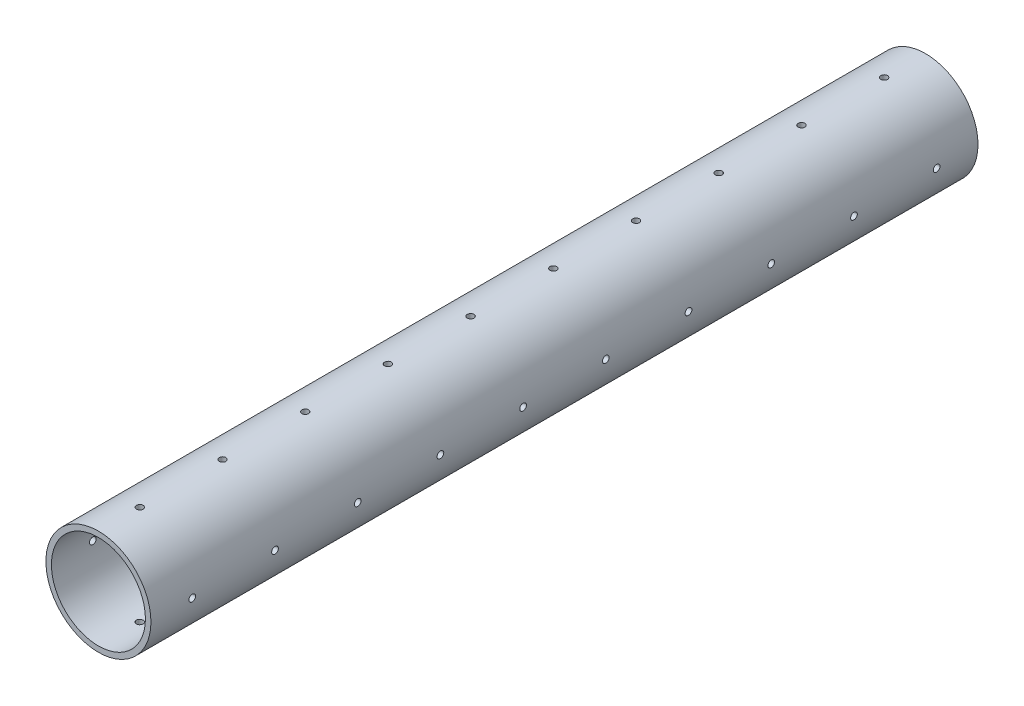
from build123d import *

# Parameters (mm, degrees)
SKETCH1_R                           = 15.875
SKETCH1_R_2                         = 14.210807843
BOSS_EXTRUDE1_DEPTH                 = 250
CUT_EXTRUDE1_REACH                  = 253.006
CUT_EXTRUDE1_END_RADIUS             = 15.875
SKETCH2_R                           = 1.0125
CUT_EXTRUDE1_DIRECTION_2_REACH      = 253.006
CUT_EXTRUDE1_DIRECTION_2_END_RADIUS = 15.875
CUT_EXTRUDE2_REACH                  = 253.006
CUT_EXTRUDE2_END_RADIUS             = 15.875
SKETCH3_R                           = 1.0125
CUT_EXTRUDE2_DIRECTION_2_REACH      = 253.006
CUT_EXTRUDE2_DIRECTION_2_END_RADIUS = 15.875


with BuildPart() as part:
    # Sketch1 → Boss-Extrude1 (new body)
    with BuildSketch(Plane.XY):
        Circle(SKETCH1_R)
        Circle(SKETCH1_R_2, mode=Mode.SUBTRACT)
    extrude(amount=BOSS_EXTRUDE1_DEPTH)

    # Cut-Extrude1: up to this cylinder (the profile starts inside it)
    cut_extrude1_end = Plane(origin=(0, 0, 175), z_dir=(0, 0, -1)) * Cylinder(CUT_EXTRUDE1_END_RADIUS, 863.762, mode=Mode.PRIVATE)
    # Sketch2 → Cut-Extrude1 (cut, up to the surface)
    with BuildSketch(Plane(origin=(0, 0, 0), x_dir=(1, 0, 0), z_dir=(0, 1, 0)), mode=Mode.PRIVATE) as cut_extrude1_sk1:
        with Locations(Location((0, -12.5, 0), (0, 0, 270))):
            Circle(SKETCH2_R)
    cut_extrude1_tool1 = extrude(cut_extrude1_sk1.sketch, amount=-CUT_EXTRUDE1_REACH, mode=Mode.PRIVATE) & cut_extrude1_end
    add(cut_extrude1_tool1.solids().sort_by_distance((0, 0, 12.5))[0], mode=Mode.SUBTRACT)
    # Sketch2 → Cut-Extrude1 (cut, up to the surface)
    with BuildSketch(Plane(origin=(0, 0, 0), x_dir=(1, 0, 0), z_dir=(0, 1, 0)), mode=Mode.PRIVATE) as cut_extrude1_sk2:
        with Locations((0, -312.5)):
            Circle(SKETCH2_R)
    cut_extrude1_tool2 = extrude(cut_extrude1_sk2.sketch, amount=-CUT_EXTRUDE1_REACH, mode=Mode.PRIVATE) & cut_extrude1_end
    add(cut_extrude1_tool2.solids().sort_by_distance((0, 0, 312.5))[0], mode=Mode.SUBTRACT)
    # Sketch2 → Cut-Extrude1 (cut, up to the surface)
    with BuildSketch(Plane(origin=(0, 0, 0), x_dir=(1, 0, 0), z_dir=(0, 1, 0)), mode=Mode.PRIVATE) as cut_extrude1_sk3:
        with Locations(Location((0, -37.5, 0), (0, 0, 270))):
            Circle(SKETCH2_R)
    cut_extrude1_tool3 = extrude(cut_extrude1_sk3.sketch, amount=-CUT_EXTRUDE1_REACH, mode=Mode.PRIVATE) & cut_extrude1_end
    add(cut_extrude1_tool3.solids().sort_by_distance((0, 0, 37.5))[0], mode=Mode.SUBTRACT)
    # Sketch2 → Cut-Extrude1 (cut, up to the surface)
    with BuildSketch(Plane(origin=(0, 0, 0), x_dir=(1, 0, 0), z_dir=(0, 1, 0)), mode=Mode.PRIVATE) as cut_extrude1_sk4:
        with Locations(Location((0, -62.5, 0), (0, 0, 270))):
            Circle(SKETCH2_R)
    cut_extrude1_tool4 = extrude(cut_extrude1_sk4.sketch, amount=-CUT_EXTRUDE1_REACH, mode=Mode.PRIVATE) & cut_extrude1_end
    add(cut_extrude1_tool4.solids().sort_by_distance((0, 0, 62.5))[0], mode=Mode.SUBTRACT)
    # Sketch2 → Cut-Extrude1 (cut, up to the surface)
    with BuildSketch(Plane(origin=(0, 0, 0), x_dir=(1, 0, 0), z_dir=(0, 1, 0)), mode=Mode.PRIVATE) as cut_extrude1_sk5:
        with Locations(Location((0, -87.5, 0), (0, 0, 270))):
            Circle(SKETCH2_R)
    cut_extrude1_tool5 = extrude(cut_extrude1_sk5.sketch, amount=-CUT_EXTRUDE1_REACH, mode=Mode.PRIVATE) & cut_extrude1_end
    add(cut_extrude1_tool5.solids().sort_by_distance((0, 0, 87.5))[0], mode=Mode.SUBTRACT)
    # Sketch2 → Cut-Extrude1 (cut, up to the surface)
    with BuildSketch(Plane(origin=(0, 0, 0), x_dir=(1, 0, 0), z_dir=(0, 1, 0)), mode=Mode.PRIVATE) as cut_extrude1_sk6:
        with Locations(Location((0, -112.5, 0), (0, 0, 270))):
            Circle(SKETCH2_R)
    cut_extrude1_tool6 = extrude(cut_extrude1_sk6.sketch, amount=-CUT_EXTRUDE1_REACH, mode=Mode.PRIVATE) & cut_extrude1_end
    add(cut_extrude1_tool6.solids().sort_by_distance((0, 0, 112.5))[0], mode=Mode.SUBTRACT)
    # Sketch2 → Cut-Extrude1 (cut, up to the surface)
    with BuildSketch(Plane(origin=(0, 0, 0), x_dir=(1, 0, 0), z_dir=(0, 1, 0)), mode=Mode.PRIVATE) as cut_extrude1_sk7:
        with Locations(Location((0, -137.5, 0), (0, 0, 270))):
            Circle(SKETCH2_R)
    cut_extrude1_tool7 = extrude(cut_extrude1_sk7.sketch, amount=-CUT_EXTRUDE1_REACH, mode=Mode.PRIVATE) & cut_extrude1_end
    add(cut_extrude1_tool7.solids().sort_by_distance((0, 0, 137.5))[0], mode=Mode.SUBTRACT)
    # Sketch2 → Cut-Extrude1 (cut, up to the surface)
    with BuildSketch(Plane(origin=(0, 0, 0), x_dir=(1, 0, 0), z_dir=(0, 1, 0)), mode=Mode.PRIVATE) as cut_extrude1_sk8:
        with Locations(Location((0, -162.5, 0), (0, 0, 270))):
            Circle(SKETCH2_R)
    cut_extrude1_tool8 = extrude(cut_extrude1_sk8.sketch, amount=-CUT_EXTRUDE1_REACH, mode=Mode.PRIVATE) & cut_extrude1_end
    add(cut_extrude1_tool8.solids().sort_by_distance((0, 0, 162.5))[0], mode=Mode.SUBTRACT)
    # Sketch2 → Cut-Extrude1 (cut, up to the surface)
    with BuildSketch(Plane(origin=(0, 0, 0), x_dir=(1, 0, 0), z_dir=(0, 1, 0)), mode=Mode.PRIVATE) as cut_extrude1_sk9:
        with Locations(Location((0, -187.5, 0), (0, 0, 270))):
            Circle(SKETCH2_R)
    cut_extrude1_tool9 = extrude(cut_extrude1_sk9.sketch, amount=-CUT_EXTRUDE1_REACH, mode=Mode.PRIVATE) & cut_extrude1_end
    add(cut_extrude1_tool9.solids().sort_by_distance((0, 0, 187.5))[0], mode=Mode.SUBTRACT)
    # Sketch2 → Cut-Extrude1 (cut, up to the surface)
    with BuildSketch(Plane(origin=(0, 0, 0), x_dir=(1, 0, 0), z_dir=(0, 1, 0)), mode=Mode.PRIVATE) as cut_extrude1_sk10:
        with Locations(Location((0, -212.5, 0), (0, 0, 270))):
            Circle(SKETCH2_R)
    cut_extrude1_tool10 = extrude(cut_extrude1_sk10.sketch, amount=-CUT_EXTRUDE1_REACH, mode=Mode.PRIVATE) & cut_extrude1_end
    add(cut_extrude1_tool10.solids().sort_by_distance((0, 0, 212.5))[0], mode=Mode.SUBTRACT)
    # Sketch2 → Cut-Extrude1 (cut, up to the surface)
    with BuildSketch(Plane(origin=(0, 0, 0), x_dir=(1, 0, 0), z_dir=(0, 1, 0)), mode=Mode.PRIVATE) as cut_extrude1_sk11:
        with Locations(Location((0, -237.5, 0), (0, 0, 270))):
            Circle(SKETCH2_R)
    cut_extrude1_tool11 = extrude(cut_extrude1_sk11.sketch, amount=-CUT_EXTRUDE1_REACH, mode=Mode.PRIVATE) & cut_extrude1_end
    add(cut_extrude1_tool11.solids().sort_by_distance((0, 0, 237.5))[0], mode=Mode.SUBTRACT)
    # Sketch2 → Cut-Extrude1 (cut, up to the surface)
    with BuildSketch(Plane(origin=(0, 0, 0), x_dir=(1, 0, 0), z_dir=(0, 1, 0)), mode=Mode.PRIVATE) as cut_extrude1_sk12:
        with Locations((0, -262.5)):
            Circle(SKETCH2_R)
    cut_extrude1_tool12 = extrude(cut_extrude1_sk12.sketch, amount=-CUT_EXTRUDE1_REACH, mode=Mode.PRIVATE) & cut_extrude1_end
    add(cut_extrude1_tool12.solids().sort_by_distance((0, 0, 262.5))[0], mode=Mode.SUBTRACT)
    # Sketch2 → Cut-Extrude1 (cut, up to the surface)
    with BuildSketch(Plane(origin=(0, 0, 0), x_dir=(1, 0, 0), z_dir=(0, 1, 0)), mode=Mode.PRIVATE) as cut_extrude1_sk13:
        with Locations((0, -287.5)):
            Circle(SKETCH2_R)
    cut_extrude1_tool13 = extrude(cut_extrude1_sk13.sketch, amount=-CUT_EXTRUDE1_REACH, mode=Mode.PRIVATE) & cut_extrude1_end
    add(cut_extrude1_tool13.solids().sort_by_distance((0, 0, 287.5))[0], mode=Mode.SUBTRACT)
    # Sketch2 → Cut-Extrude1 (cut, up to the surface)
    with BuildSketch(Plane(origin=(0, 0, 0), x_dir=(1, 0, 0), z_dir=(0, 1, 0)), mode=Mode.PRIVATE) as cut_extrude1_sk14:
        with Locations((0, -337.5)):
            Circle(SKETCH2_R)
    cut_extrude1_tool14 = extrude(cut_extrude1_sk14.sketch, amount=-CUT_EXTRUDE1_REACH, mode=Mode.PRIVATE) & cut_extrude1_end
    add(cut_extrude1_tool14.solids().sort_by_distance((0, 0, 337.5))[0], mode=Mode.SUBTRACT)

    # Cut-Extrude1 direction 2: up to this cylinder (the profile starts inside it)
    cut_extrude1_direction_2_end = Plane(origin=(0, 0, 175), z_dir=(0, 0, -1)) * Cylinder(CUT_EXTRUDE1_DIRECTION_2_END_RADIUS, 863.762, mode=Mode.PRIVATE)
    # Sketch2 → Cut-Extrude1 direction 2 (cut, up to the surface)
    with BuildSketch(Plane(origin=(0, 0, 0), x_dir=(1, 0, 0), z_dir=(0, 1, 0)), mode=Mode.PRIVATE) as cut_extrude1_direction_2_sk1:
        with Locations(Location((0, -12.5, 0), (0, 0, 270))):
            Circle(SKETCH2_R)
    cut_extrude1_direction_2_tool1 = extrude(cut_extrude1_direction_2_sk1.sketch, amount=CUT_EXTRUDE1_DIRECTION_2_REACH, mode=Mode.PRIVATE) & cut_extrude1_direction_2_end
    add(cut_extrude1_direction_2_tool1.solids().sort_by_distance((0, 0, 12.5))[0], mode=Mode.SUBTRACT)
    # Sketch2 → Cut-Extrude1 direction 2 (cut, up to the surface)
    with BuildSketch(Plane(origin=(0, 0, 0), x_dir=(1, 0, 0), z_dir=(0, 1, 0)), mode=Mode.PRIVATE) as cut_extrude1_direction_2_sk2:
        with Locations((0, -312.5)):
            Circle(SKETCH2_R)
    cut_extrude1_direction_2_tool2 = extrude(cut_extrude1_direction_2_sk2.sketch, amount=CUT_EXTRUDE1_DIRECTION_2_REACH, mode=Mode.PRIVATE) & cut_extrude1_direction_2_end
    add(cut_extrude1_direction_2_tool2.solids().sort_by_distance((0, 0, 312.5))[0], mode=Mode.SUBTRACT)
    # Sketch2 → Cut-Extrude1 direction 2 (cut, up to the surface)
    with BuildSketch(Plane(origin=(0, 0, 0), x_dir=(1, 0, 0), z_dir=(0, 1, 0)), mode=Mode.PRIVATE) as cut_extrude1_direction_2_sk3:
        with Locations(Location((0, -37.5, 0), (0, 0, 270))):
            Circle(SKETCH2_R)
    cut_extrude1_direction_2_tool3 = extrude(cut_extrude1_direction_2_sk3.sketch, amount=CUT_EXTRUDE1_DIRECTION_2_REACH, mode=Mode.PRIVATE) & cut_extrude1_direction_2_end
    add(cut_extrude1_direction_2_tool3.solids().sort_by_distance((0, 0, 37.5))[0], mode=Mode.SUBTRACT)
    # Sketch2 → Cut-Extrude1 direction 2 (cut, up to the surface)
    with BuildSketch(Plane(origin=(0, 0, 0), x_dir=(1, 0, 0), z_dir=(0, 1, 0)), mode=Mode.PRIVATE) as cut_extrude1_direction_2_sk4:
        with Locations(Location((0, -62.5, 0), (0, 0, 270))):
            Circle(SKETCH2_R)
    cut_extrude1_direction_2_tool4 = extrude(cut_extrude1_direction_2_sk4.sketch, amount=CUT_EXTRUDE1_DIRECTION_2_REACH, mode=Mode.PRIVATE) & cut_extrude1_direction_2_end
    add(cut_extrude1_direction_2_tool4.solids().sort_by_distance((0, 0, 62.5))[0], mode=Mode.SUBTRACT)
    # Sketch2 → Cut-Extrude1 direction 2 (cut, up to the surface)
    with BuildSketch(Plane(origin=(0, 0, 0), x_dir=(1, 0, 0), z_dir=(0, 1, 0)), mode=Mode.PRIVATE) as cut_extrude1_direction_2_sk5:
        with Locations(Location((0, -87.5, 0), (0, 0, 270))):
            Circle(SKETCH2_R)
    cut_extrude1_direction_2_tool5 = extrude(cut_extrude1_direction_2_sk5.sketch, amount=CUT_EXTRUDE1_DIRECTION_2_REACH, mode=Mode.PRIVATE) & cut_extrude1_direction_2_end
    add(cut_extrude1_direction_2_tool5.solids().sort_by_distance((0, 0, 87.5))[0], mode=Mode.SUBTRACT)
    # Sketch2 → Cut-Extrude1 direction 2 (cut, up to the surface)
    with BuildSketch(Plane(origin=(0, 0, 0), x_dir=(1, 0, 0), z_dir=(0, 1, 0)), mode=Mode.PRIVATE) as cut_extrude1_direction_2_sk6:
        with Locations(Location((0, -112.5, 0), (0, 0, 270))):
            Circle(SKETCH2_R)
    cut_extrude1_direction_2_tool6 = extrude(cut_extrude1_direction_2_sk6.sketch, amount=CUT_EXTRUDE1_DIRECTION_2_REACH, mode=Mode.PRIVATE) & cut_extrude1_direction_2_end
    add(cut_extrude1_direction_2_tool6.solids().sort_by_distance((0, 0, 112.5))[0], mode=Mode.SUBTRACT)
    # Sketch2 → Cut-Extrude1 direction 2 (cut, up to the surface)
    with BuildSketch(Plane(origin=(0, 0, 0), x_dir=(1, 0, 0), z_dir=(0, 1, 0)), mode=Mode.PRIVATE) as cut_extrude1_direction_2_sk7:
        with Locations(Location((0, -137.5, 0), (0, 0, 270))):
            Circle(SKETCH2_R)
    cut_extrude1_direction_2_tool7 = extrude(cut_extrude1_direction_2_sk7.sketch, amount=CUT_EXTRUDE1_DIRECTION_2_REACH, mode=Mode.PRIVATE) & cut_extrude1_direction_2_end
    add(cut_extrude1_direction_2_tool7.solids().sort_by_distance((0, 0, 137.5))[0], mode=Mode.SUBTRACT)
    # Sketch2 → Cut-Extrude1 direction 2 (cut, up to the surface)
    with BuildSketch(Plane(origin=(0, 0, 0), x_dir=(1, 0, 0), z_dir=(0, 1, 0)), mode=Mode.PRIVATE) as cut_extrude1_direction_2_sk8:
        with Locations(Location((0, -162.5, 0), (0, 0, 270))):
            Circle(SKETCH2_R)
    cut_extrude1_direction_2_tool8 = extrude(cut_extrude1_direction_2_sk8.sketch, amount=CUT_EXTRUDE1_DIRECTION_2_REACH, mode=Mode.PRIVATE) & cut_extrude1_direction_2_end
    add(cut_extrude1_direction_2_tool8.solids().sort_by_distance((0, 0, 162.5))[0], mode=Mode.SUBTRACT)
    # Sketch2 → Cut-Extrude1 direction 2 (cut, up to the surface)
    with BuildSketch(Plane(origin=(0, 0, 0), x_dir=(1, 0, 0), z_dir=(0, 1, 0)), mode=Mode.PRIVATE) as cut_extrude1_direction_2_sk9:
        with Locations(Location((0, -187.5, 0), (0, 0, 270))):
            Circle(SKETCH2_R)
    cut_extrude1_direction_2_tool9 = extrude(cut_extrude1_direction_2_sk9.sketch, amount=CUT_EXTRUDE1_DIRECTION_2_REACH, mode=Mode.PRIVATE) & cut_extrude1_direction_2_end
    add(cut_extrude1_direction_2_tool9.solids().sort_by_distance((0, 0, 187.5))[0], mode=Mode.SUBTRACT)
    # Sketch2 → Cut-Extrude1 direction 2 (cut, up to the surface)
    with BuildSketch(Plane(origin=(0, 0, 0), x_dir=(1, 0, 0), z_dir=(0, 1, 0)), mode=Mode.PRIVATE) as cut_extrude1_direction_2_sk10:
        with Locations(Location((0, -212.5, 0), (0, 0, 270))):
            Circle(SKETCH2_R)
    cut_extrude1_direction_2_tool10 = extrude(cut_extrude1_direction_2_sk10.sketch, amount=CUT_EXTRUDE1_DIRECTION_2_REACH, mode=Mode.PRIVATE) & cut_extrude1_direction_2_end
    add(cut_extrude1_direction_2_tool10.solids().sort_by_distance((0, 0, 212.5))[0], mode=Mode.SUBTRACT)
    # Sketch2 → Cut-Extrude1 direction 2 (cut, up to the surface)
    with BuildSketch(Plane(origin=(0, 0, 0), x_dir=(1, 0, 0), z_dir=(0, 1, 0)), mode=Mode.PRIVATE) as cut_extrude1_direction_2_sk11:
        with Locations(Location((0, -237.5, 0), (0, 0, 270))):
            Circle(SKETCH2_R)
    cut_extrude1_direction_2_tool11 = extrude(cut_extrude1_direction_2_sk11.sketch, amount=CUT_EXTRUDE1_DIRECTION_2_REACH, mode=Mode.PRIVATE) & cut_extrude1_direction_2_end
    add(cut_extrude1_direction_2_tool11.solids().sort_by_distance((0, 0, 237.5))[0], mode=Mode.SUBTRACT)
    # Sketch2 → Cut-Extrude1 direction 2 (cut, up to the surface)
    with BuildSketch(Plane(origin=(0, 0, 0), x_dir=(1, 0, 0), z_dir=(0, 1, 0)), mode=Mode.PRIVATE) as cut_extrude1_direction_2_sk12:
        with Locations((0, -262.5)):
            Circle(SKETCH2_R)
    cut_extrude1_direction_2_tool12 = extrude(cut_extrude1_direction_2_sk12.sketch, amount=CUT_EXTRUDE1_DIRECTION_2_REACH, mode=Mode.PRIVATE) & cut_extrude1_direction_2_end
    add(cut_extrude1_direction_2_tool12.solids().sort_by_distance((0, 0, 262.5))[0], mode=Mode.SUBTRACT)
    # Sketch2 → Cut-Extrude1 direction 2 (cut, up to the surface)
    with BuildSketch(Plane(origin=(0, 0, 0), x_dir=(1, 0, 0), z_dir=(0, 1, 0)), mode=Mode.PRIVATE) as cut_extrude1_direction_2_sk13:
        with Locations((0, -287.5)):
            Circle(SKETCH2_R)
    cut_extrude1_direction_2_tool13 = extrude(cut_extrude1_direction_2_sk13.sketch, amount=CUT_EXTRUDE1_DIRECTION_2_REACH, mode=Mode.PRIVATE) & cut_extrude1_direction_2_end
    add(cut_extrude1_direction_2_tool13.solids().sort_by_distance((0, 0, 287.5))[0], mode=Mode.SUBTRACT)
    # Sketch2 → Cut-Extrude1 direction 2 (cut, up to the surface)
    with BuildSketch(Plane(origin=(0, 0, 0), x_dir=(1, 0, 0), z_dir=(0, 1, 0)), mode=Mode.PRIVATE) as cut_extrude1_direction_2_sk14:
        with Locations((0, -337.5)):
            Circle(SKETCH2_R)
    cut_extrude1_direction_2_tool14 = extrude(cut_extrude1_direction_2_sk14.sketch, amount=CUT_EXTRUDE1_DIRECTION_2_REACH, mode=Mode.PRIVATE) & cut_extrude1_direction_2_end
    add(cut_extrude1_direction_2_tool14.solids().sort_by_distance((0, 0, 337.5))[0], mode=Mode.SUBTRACT)

    # Cut-Extrude2: up to this cylinder (the profile starts inside it)
    cut_extrude2_end = Plane(origin=(0, 0, 150), z_dir=(0, 0, -1)) * Cylinder(CUT_EXTRUDE2_END_RADIUS, 813.762, mode=Mode.PRIVATE)
    # Sketch3 → Cut-Extrude2 (cut, up to the surface)
    with BuildSketch(Plane(origin=(0, 0, 0), x_dir=(0, 0, -1), z_dir=(1, 0, 0)), mode=Mode.PRIVATE) as cut_extrude2_sk1:
        with Locations((-12.5, 0)):
            Circle(SKETCH3_R)
    cut_extrude2_tool1 = extrude(cut_extrude2_sk1.sketch, amount=-CUT_EXTRUDE2_REACH, mode=Mode.PRIVATE) & cut_extrude2_end
    add(cut_extrude2_tool1.solids().sort_by_distance((0, 0, 12.5))[0], mode=Mode.SUBTRACT)
    # Sketch3 → Cut-Extrude2 (cut, up to the surface)
    with BuildSketch(Plane(origin=(0, 0, 0), x_dir=(0, 0, -1), z_dir=(1, 0, 0)), mode=Mode.PRIVATE) as cut_extrude2_sk2:
        with Locations((-37.5, 0)):
            Circle(SKETCH3_R)
    cut_extrude2_tool2 = extrude(cut_extrude2_sk2.sketch, amount=-CUT_EXTRUDE2_REACH, mode=Mode.PRIVATE) & cut_extrude2_end
    add(cut_extrude2_tool2.solids().sort_by_distance((0, 0, 37.5))[0], mode=Mode.SUBTRACT)
    # Sketch3 → Cut-Extrude2 (cut, up to the surface)
    with BuildSketch(Plane(origin=(0, 0, 0), x_dir=(0, 0, -1), z_dir=(1, 0, 0)), mode=Mode.PRIVATE) as cut_extrude2_sk3:
        with Locations((-62.5, 0)):
            Circle(SKETCH3_R)
    cut_extrude2_tool3 = extrude(cut_extrude2_sk3.sketch, amount=-CUT_EXTRUDE2_REACH, mode=Mode.PRIVATE) & cut_extrude2_end
    add(cut_extrude2_tool3.solids().sort_by_distance((0, 0, 62.5))[0], mode=Mode.SUBTRACT)
    # Sketch3 → Cut-Extrude2 (cut, up to the surface)
    with BuildSketch(Plane(origin=(0, 0, 0), x_dir=(0, 0, -1), z_dir=(1, 0, 0)), mode=Mode.PRIVATE) as cut_extrude2_sk4:
        with Locations((-87.5, 0)):
            Circle(SKETCH3_R)
    cut_extrude2_tool4 = extrude(cut_extrude2_sk4.sketch, amount=-CUT_EXTRUDE2_REACH, mode=Mode.PRIVATE) & cut_extrude2_end
    add(cut_extrude2_tool4.solids().sort_by_distance((0, 0, 87.5))[0], mode=Mode.SUBTRACT)
    # Sketch3 → Cut-Extrude2 (cut, up to the surface)
    with BuildSketch(Plane(origin=(0, 0, 0), x_dir=(0, 0, -1), z_dir=(1, 0, 0)), mode=Mode.PRIVATE) as cut_extrude2_sk5:
        with Locations((-112.5, 0)):
            Circle(SKETCH3_R)
    cut_extrude2_tool5 = extrude(cut_extrude2_sk5.sketch, amount=-CUT_EXTRUDE2_REACH, mode=Mode.PRIVATE) & cut_extrude2_end
    add(cut_extrude2_tool5.solids().sort_by_distance((0, 0, 112.5))[0], mode=Mode.SUBTRACT)
    # Sketch3 → Cut-Extrude2 (cut, up to the surface)
    with BuildSketch(Plane(origin=(0, 0, 0), x_dir=(0, 0, -1), z_dir=(1, 0, 0)), mode=Mode.PRIVATE) as cut_extrude2_sk6:
        with Locations((-137.5, 0)):
            Circle(SKETCH3_R)
    cut_extrude2_tool6 = extrude(cut_extrude2_sk6.sketch, amount=-CUT_EXTRUDE2_REACH, mode=Mode.PRIVATE) & cut_extrude2_end
    add(cut_extrude2_tool6.solids().sort_by_distance((0, 0, 137.5))[0], mode=Mode.SUBTRACT)
    # Sketch3 → Cut-Extrude2 (cut, up to the surface)
    with BuildSketch(Plane(origin=(0, 0, 0), x_dir=(0, 0, -1), z_dir=(1, 0, 0)), mode=Mode.PRIVATE) as cut_extrude2_sk7:
        with Locations((-162.5, 0)):
            Circle(SKETCH3_R)
    cut_extrude2_tool7 = extrude(cut_extrude2_sk7.sketch, amount=-CUT_EXTRUDE2_REACH, mode=Mode.PRIVATE) & cut_extrude2_end
    add(cut_extrude2_tool7.solids().sort_by_distance((0, 0, 162.5))[0], mode=Mode.SUBTRACT)
    # Sketch3 → Cut-Extrude2 (cut, up to the surface)
    with BuildSketch(Plane(origin=(0, 0, 0), x_dir=(0, 0, -1), z_dir=(1, 0, 0)), mode=Mode.PRIVATE) as cut_extrude2_sk8:
        with Locations((-187.5, 0)):
            Circle(SKETCH3_R)
    cut_extrude2_tool8 = extrude(cut_extrude2_sk8.sketch, amount=-CUT_EXTRUDE2_REACH, mode=Mode.PRIVATE) & cut_extrude2_end
    add(cut_extrude2_tool8.solids().sort_by_distance((0, 0, 187.5))[0], mode=Mode.SUBTRACT)
    # Sketch3 → Cut-Extrude2 (cut, up to the surface)
    with BuildSketch(Plane(origin=(0, 0, 0), x_dir=(0, 0, -1), z_dir=(1, 0, 0)), mode=Mode.PRIVATE) as cut_extrude2_sk9:
        with Locations((-212.5, 0)):
            Circle(SKETCH3_R)
    cut_extrude2_tool9 = extrude(cut_extrude2_sk9.sketch, amount=-CUT_EXTRUDE2_REACH, mode=Mode.PRIVATE) & cut_extrude2_end
    add(cut_extrude2_tool9.solids().sort_by_distance((0, 0, 212.5))[0], mode=Mode.SUBTRACT)
    # Sketch3 → Cut-Extrude2 (cut, up to the surface)
    with BuildSketch(Plane(origin=(0, 0, 0), x_dir=(0, 0, -1), z_dir=(1, 0, 0)), mode=Mode.PRIVATE) as cut_extrude2_sk10:
        with Locations((-237.5, 0)):
            Circle(SKETCH3_R)
    cut_extrude2_tool10 = extrude(cut_extrude2_sk10.sketch, amount=-CUT_EXTRUDE2_REACH, mode=Mode.PRIVATE) & cut_extrude2_end
    add(cut_extrude2_tool10.solids().sort_by_distance((0, 0, 237.5))[0], mode=Mode.SUBTRACT)
    # Sketch3 → Cut-Extrude2 (cut, up to the surface)
    with BuildSketch(Plane(origin=(0, 0, 0), x_dir=(0, 0, -1), z_dir=(1, 0, 0)), mode=Mode.PRIVATE) as cut_extrude2_sk11:
        with Locations((-262.5, 0)):
            Circle(SKETCH3_R)
    cut_extrude2_tool11 = extrude(cut_extrude2_sk11.sketch, amount=-CUT_EXTRUDE2_REACH, mode=Mode.PRIVATE) & cut_extrude2_end
    add(cut_extrude2_tool11.solids().sort_by_distance((0, 0, 262.5))[0], mode=Mode.SUBTRACT)
    # Sketch3 → Cut-Extrude2 (cut, up to the surface)
    with BuildSketch(Plane(origin=(0, 0, 0), x_dir=(0, 0, -1), z_dir=(1, 0, 0)), mode=Mode.PRIVATE) as cut_extrude2_sk12:
        with Locations((-287.5, 0)):
            Circle(SKETCH3_R)
    cut_extrude2_tool12 = extrude(cut_extrude2_sk12.sketch, amount=-CUT_EXTRUDE2_REACH, mode=Mode.PRIVATE) & cut_extrude2_end
    add(cut_extrude2_tool12.solids().sort_by_distance((0, 0, 287.5))[0], mode=Mode.SUBTRACT)

    # Cut-Extrude2 direction 2: up to this cylinder (the profile starts inside it)
    cut_extrude2_direction_2_end = Plane(origin=(0, 0, 150), z_dir=(0, 0, -1)) * Cylinder(CUT_EXTRUDE2_DIRECTION_2_END_RADIUS, 813.762, mode=Mode.PRIVATE)
    # Sketch3 → Cut-Extrude2 direction 2 (cut, up to the surface)
    with BuildSketch(Plane(origin=(0, 0, 0), x_dir=(0, 0, -1), z_dir=(1, 0, 0)), mode=Mode.PRIVATE) as cut_extrude2_direction_2_sk1:
        with Locations((-12.5, 0)):
            Circle(SKETCH3_R)
    cut_extrude2_direction_2_tool1 = extrude(cut_extrude2_direction_2_sk1.sketch, amount=CUT_EXTRUDE2_DIRECTION_2_REACH, mode=Mode.PRIVATE) & cut_extrude2_direction_2_end
    add(cut_extrude2_direction_2_tool1.solids().sort_by_distance((0, 0, 12.5))[0], mode=Mode.SUBTRACT)
    # Sketch3 → Cut-Extrude2 direction 2 (cut, up to the surface)
    with BuildSketch(Plane(origin=(0, 0, 0), x_dir=(0, 0, -1), z_dir=(1, 0, 0)), mode=Mode.PRIVATE) as cut_extrude2_direction_2_sk2:
        with Locations((-37.5, 0)):
            Circle(SKETCH3_R)
    cut_extrude2_direction_2_tool2 = extrude(cut_extrude2_direction_2_sk2.sketch, amount=CUT_EXTRUDE2_DIRECTION_2_REACH, mode=Mode.PRIVATE) & cut_extrude2_direction_2_end
    add(cut_extrude2_direction_2_tool2.solids().sort_by_distance((0, 0, 37.5))[0], mode=Mode.SUBTRACT)
    # Sketch3 → Cut-Extrude2 direction 2 (cut, up to the surface)
    with BuildSketch(Plane(origin=(0, 0, 0), x_dir=(0, 0, -1), z_dir=(1, 0, 0)), mode=Mode.PRIVATE) as cut_extrude2_direction_2_sk3:
        with Locations((-62.5, 0)):
            Circle(SKETCH3_R)
    cut_extrude2_direction_2_tool3 = extrude(cut_extrude2_direction_2_sk3.sketch, amount=CUT_EXTRUDE2_DIRECTION_2_REACH, mode=Mode.PRIVATE) & cut_extrude2_direction_2_end
    add(cut_extrude2_direction_2_tool3.solids().sort_by_distance((0, 0, 62.5))[0], mode=Mode.SUBTRACT)
    # Sketch3 → Cut-Extrude2 direction 2 (cut, up to the surface)
    with BuildSketch(Plane(origin=(0, 0, 0), x_dir=(0, 0, -1), z_dir=(1, 0, 0)), mode=Mode.PRIVATE) as cut_extrude2_direction_2_sk4:
        with Locations((-87.5, 0)):
            Circle(SKETCH3_R)
    cut_extrude2_direction_2_tool4 = extrude(cut_extrude2_direction_2_sk4.sketch, amount=CUT_EXTRUDE2_DIRECTION_2_REACH, mode=Mode.PRIVATE) & cut_extrude2_direction_2_end
    add(cut_extrude2_direction_2_tool4.solids().sort_by_distance((0, 0, 87.5))[0], mode=Mode.SUBTRACT)
    # Sketch3 → Cut-Extrude2 direction 2 (cut, up to the surface)
    with BuildSketch(Plane(origin=(0, 0, 0), x_dir=(0, 0, -1), z_dir=(1, 0, 0)), mode=Mode.PRIVATE) as cut_extrude2_direction_2_sk5:
        with Locations((-112.5, 0)):
            Circle(SKETCH3_R)
    cut_extrude2_direction_2_tool5 = extrude(cut_extrude2_direction_2_sk5.sketch, amount=CUT_EXTRUDE2_DIRECTION_2_REACH, mode=Mode.PRIVATE) & cut_extrude2_direction_2_end
    add(cut_extrude2_direction_2_tool5.solids().sort_by_distance((0, 0, 112.5))[0], mode=Mode.SUBTRACT)
    # Sketch3 → Cut-Extrude2 direction 2 (cut, up to the surface)
    with BuildSketch(Plane(origin=(0, 0, 0), x_dir=(0, 0, -1), z_dir=(1, 0, 0)), mode=Mode.PRIVATE) as cut_extrude2_direction_2_sk6:
        with Locations((-137.5, 0)):
            Circle(SKETCH3_R)
    cut_extrude2_direction_2_tool6 = extrude(cut_extrude2_direction_2_sk6.sketch, amount=CUT_EXTRUDE2_DIRECTION_2_REACH, mode=Mode.PRIVATE) & cut_extrude2_direction_2_end
    add(cut_extrude2_direction_2_tool6.solids().sort_by_distance((0, 0, 137.5))[0], mode=Mode.SUBTRACT)
    # Sketch3 → Cut-Extrude2 direction 2 (cut, up to the surface)
    with BuildSketch(Plane(origin=(0, 0, 0), x_dir=(0, 0, -1), z_dir=(1, 0, 0)), mode=Mode.PRIVATE) as cut_extrude2_direction_2_sk7:
        with Locations((-162.5, 0)):
            Circle(SKETCH3_R)
    cut_extrude2_direction_2_tool7 = extrude(cut_extrude2_direction_2_sk7.sketch, amount=CUT_EXTRUDE2_DIRECTION_2_REACH, mode=Mode.PRIVATE) & cut_extrude2_direction_2_end
    add(cut_extrude2_direction_2_tool7.solids().sort_by_distance((0, 0, 162.5))[0], mode=Mode.SUBTRACT)
    # Sketch3 → Cut-Extrude2 direction 2 (cut, up to the surface)
    with BuildSketch(Plane(origin=(0, 0, 0), x_dir=(0, 0, -1), z_dir=(1, 0, 0)), mode=Mode.PRIVATE) as cut_extrude2_direction_2_sk8:
        with Locations((-187.5, 0)):
            Circle(SKETCH3_R)
    cut_extrude2_direction_2_tool8 = extrude(cut_extrude2_direction_2_sk8.sketch, amount=CUT_EXTRUDE2_DIRECTION_2_REACH, mode=Mode.PRIVATE) & cut_extrude2_direction_2_end
    add(cut_extrude2_direction_2_tool8.solids().sort_by_distance((0, 0, 187.5))[0], mode=Mode.SUBTRACT)
    # Sketch3 → Cut-Extrude2 direction 2 (cut, up to the surface)
    with BuildSketch(Plane(origin=(0, 0, 0), x_dir=(0, 0, -1), z_dir=(1, 0, 0)), mode=Mode.PRIVATE) as cut_extrude2_direction_2_sk9:
        with Locations((-212.5, 0)):
            Circle(SKETCH3_R)
    cut_extrude2_direction_2_tool9 = extrude(cut_extrude2_direction_2_sk9.sketch, amount=CUT_EXTRUDE2_DIRECTION_2_REACH, mode=Mode.PRIVATE) & cut_extrude2_direction_2_end
    add(cut_extrude2_direction_2_tool9.solids().sort_by_distance((0, 0, 212.5))[0], mode=Mode.SUBTRACT)
    # Sketch3 → Cut-Extrude2 direction 2 (cut, up to the surface)
    with BuildSketch(Plane(origin=(0, 0, 0), x_dir=(0, 0, -1), z_dir=(1, 0, 0)), mode=Mode.PRIVATE) as cut_extrude2_direction_2_sk10:
        with Locations((-237.5, 0)):
            Circle(SKETCH3_R)
    cut_extrude2_direction_2_tool10 = extrude(cut_extrude2_direction_2_sk10.sketch, amount=CUT_EXTRUDE2_DIRECTION_2_REACH, mode=Mode.PRIVATE) & cut_extrude2_direction_2_end
    add(cut_extrude2_direction_2_tool10.solids().sort_by_distance((0, 0, 237.5))[0], mode=Mode.SUBTRACT)
    # Sketch3 → Cut-Extrude2 direction 2 (cut, up to the surface)
    with BuildSketch(Plane(origin=(0, 0, 0), x_dir=(0, 0, -1), z_dir=(1, 0, 0)), mode=Mode.PRIVATE) as cut_extrude2_direction_2_sk11:
        with Locations((-262.5, 0)):
            Circle(SKETCH3_R)
    cut_extrude2_direction_2_tool11 = extrude(cut_extrude2_direction_2_sk11.sketch, amount=CUT_EXTRUDE2_DIRECTION_2_REACH, mode=Mode.PRIVATE) & cut_extrude2_direction_2_end
    add(cut_extrude2_direction_2_tool11.solids().sort_by_distance((0, 0, 262.5))[0], mode=Mode.SUBTRACT)
    # Sketch3 → Cut-Extrude2 direction 2 (cut, up to the surface)
    with BuildSketch(Plane(origin=(0, 0, 0), x_dir=(0, 0, -1), z_dir=(1, 0, 0)), mode=Mode.PRIVATE) as cut_extrude2_direction_2_sk12:
        with Locations((-287.5, 0)):
            Circle(SKETCH3_R)
    cut_extrude2_direction_2_tool12 = extrude(cut_extrude2_direction_2_sk12.sketch, amount=CUT_EXTRUDE2_DIRECTION_2_REACH, mode=Mode.PRIVATE) & cut_extrude2_direction_2_end
    add(cut_extrude2_direction_2_tool12.solids().sort_by_distance((0, 0, 287.5))[0], mode=Mode.SUBTRACT)


solid = part.part
